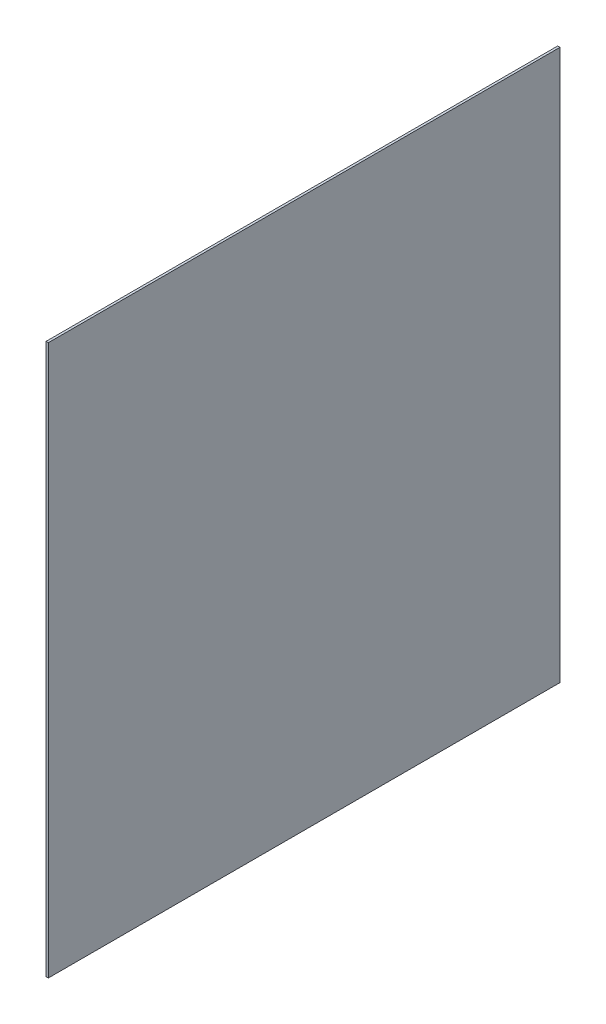
from build123d import *

# Parameters (mm, degrees)
SKETCH1_W           = 3.175
SKETCH1_H           = 706.12
BOSS_EXTRUDE1_DEPTH = 759.46


with BuildPart() as part:
    # Sketch1 → Boss-Extrude1 (new body)
    with BuildSketch(Plane(origin=(0, 0, 0), x_dir=(1, 0, 0), z_dir=(0, 1, 0))):
        Rectangle(SKETCH1_W, SKETCH1_H)
    extrude(amount=BOSS_EXTRUDE1_DEPTH)


solid = part.part
